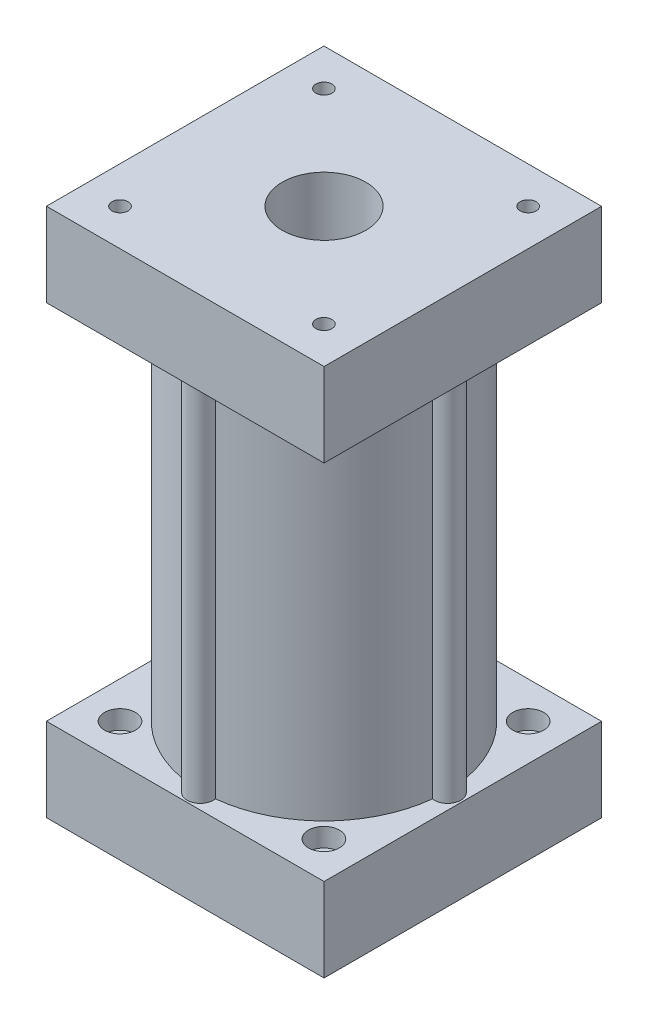
from build123d import *

# Parameters (mm, degrees)
SKETCH1_W           = 42.1894
SKETCH1_H           = 42.164
SKETCH1_R           = 16.51
SKETCH1_R_2         = 1.25
BOSS_EXTRUDE1_DEPTH = 12.7
SKETCH2_R           = 2
BOSS_EXTRUDE2_DEPTH = 55.0672
SKETCH3_W           = 42.1894
SKETCH3_H           = 42.164
SKETCH3_R           = 6.35
BOSS_EXTRUDE3_DEPTH = 12.7
SKETCH4_R           = 1.2192
CUT_EXTRUDE1_DEPTH  = 94.082694186
SKETCH5_R           = 2.3495
CUT_EXTRUDE2_DEPTH  = 2.8448
SKETCH7_R           = 2.3368
CUT_EXTRUDE3_DEPTH  = 2.8448
SKETCH8_R           = 18.565
SKETCH8_R_2         = 16.51
BOSS_EXTRUDE5_DEPTH = 67.564


with BuildPart() as part:
    # Sketch1 → Boss-Extrude1 (new body)
    with BuildSketch(Plane(origin=(0, 0, 0), x_dir=(1, 0, 0), z_dir=(0, 1, 0))):
        with Locations((16.511120943, -6.760771275)):
            Rectangle(SKETCH1_W, SKETCH1_H)
        with Locations(Location((16.511120943, -6.773471275, 0), (0, 0, 270))):
            Circle(SKETCH1_R, mode=Mode.SUBTRACT)
        with Locations(Location((32.030520943, 8.745928725, 0), (0, 0, 270))):
            Circle(SKETCH1_R_2, mode=Mode.SUBTRACT)
        with Locations(Location((1.020179134, 8.717470534, 0), (0, 0, 270))):
            Circle(SKETCH1_R_2, mode=Mode.SUBTRACT)
        with Locations(Location((1.020179134, -22.264413084, 0), (0, 0, 270))):
            Circle(SKETCH1_R_2, mode=Mode.SUBTRACT)
        with Locations(Location((32.002062752, -22.264413084, 0), (0, 0, 270))):
            Circle(SKETCH1_R_2, mode=Mode.SUBTRACT)
    extrude(amount=BOSS_EXTRUDE1_DEPTH)

    # Sketch2 → Boss-Extrude2 (add)
    with BuildSketch(Plane(origin=(0, 12.7, 0), x_dir=(1, 0, 0), z_dir=(0, 1, 0))):
        with Locations(Location((16.511120943, 12.028878725, 0), (0, 0, 90))):
            Circle(SKETCH2_R)
        with Locations(Location((-2.291229057, -6.767121275, 0), (0, 0, 90))):
            Circle(SKETCH2_R)
        with Locations(Location((35.313470943, -6.767121275, 0), (0, 0, 90))):
            Circle(SKETCH2_R)
        with Locations(Location((16.511120943, -25.563121275, 0), (0, 0, 90))):
            Circle(SKETCH2_R)
    extrude(amount=BOSS_EXTRUDE2_DEPTH)

    # Sketch3 → Boss-Extrude3 (add)
    with BuildSketch(Plane(origin=(0, 67.7672, 0), x_dir=(1, 0, 0), z_dir=(0, 1, 0))):
        with Locations((16.511120943, -6.760771275)):
            Rectangle(SKETCH3_W, SKETCH3_H)
        with Locations(Location((16.511120943, -6.760771275, 0), (0, 0, 270))):
            Circle(SKETCH3_R, mode=Mode.SUBTRACT)
    extrude(amount=BOSS_EXTRUDE3_DEPTH)

    # Sketch4 → Cut-Extrude1 (cut, through all)
    with BuildSketch(Plane.XZ):
        with Locations(Location((1.020179134, 22.264413084, 0), (0, 0, 270))):
            Circle(SKETCH4_R)
        with Locations(Location((1.020179134, -8.717470534, 0), (0, 0, 270))):
            Circle(SKETCH4_R)
        with Locations(Location((32.030520943, -8.745928725, 0), (0, 0, 270))):
            Circle(SKETCH4_R)
        with Locations(Location((32.002062752, 22.264413084, 0), (0, 0, 270))):
            Circle(SKETCH4_R)
    extrude(amount=-CUT_EXTRUDE1_DEPTH, mode=Mode.SUBTRACT)

    # Sketch5 → Cut-Extrude2 (cut)
    with BuildSketch(Plane(origin=(0, 12.7, 0), x_dir=(1, 0, 0), z_dir=(0, 1, 0))):
        with Locations(Location((32.002062752, -22.264413084, 0), (0, 0, 270))):
            Circle(SKETCH5_R)
        with Locations(Location((1.020179134, -22.264413084, 0), (0, 0, 270))):
            Circle(SKETCH5_R)
        with Locations(Location((32.030520943, 8.745928725, 0), (0, 0, 270))):
            Circle(SKETCH5_R)
        with Locations(Location((1.020179134, 8.717470534, 0), (0, 0, 270))):
            Circle(SKETCH5_R)
    extrude(amount=-CUT_EXTRUDE2_DEPTH, mode=Mode.SUBTRACT)

    # Sketch7 → Cut-Extrude3 (cut)
    with BuildSketch(Plane.XZ.offset(-67.7672)):
        with Locations(Location((32.030520943, -8.745928725, 0), (0, 0, 270))):
            Circle(SKETCH7_R)
        with Locations(Location((32.002062752, 22.264413084, 0), (0, 0, 270))):
            Circle(SKETCH7_R)
        with Locations(Location((1.020179134, -8.717470534, 0), (0, 0, 270))):
            Circle(SKETCH7_R)
        with Locations(Location((1.020179134, 22.264413084, 0), (0, 0, 270))):
            Circle(SKETCH7_R)
    extrude(amount=-CUT_EXTRUDE3_DEPTH, mode=Mode.SUBTRACT)

    # Sketch8 → Boss-Extrude5 (add)
    with BuildSketch(Plane.XZ.offset(-67.7672)):
        with Locations((16.511120943, 6.760771275)):
            Circle(SKETCH8_R)
        with Locations(Location((16.511120943, 6.760771275, 0), (0, 0, 179.977963161))):
            Circle(SKETCH8_R_2, mode=Mode.SUBTRACT)
    extrude(amount=BOSS_EXTRUDE5_DEPTH)


solid = part.part
